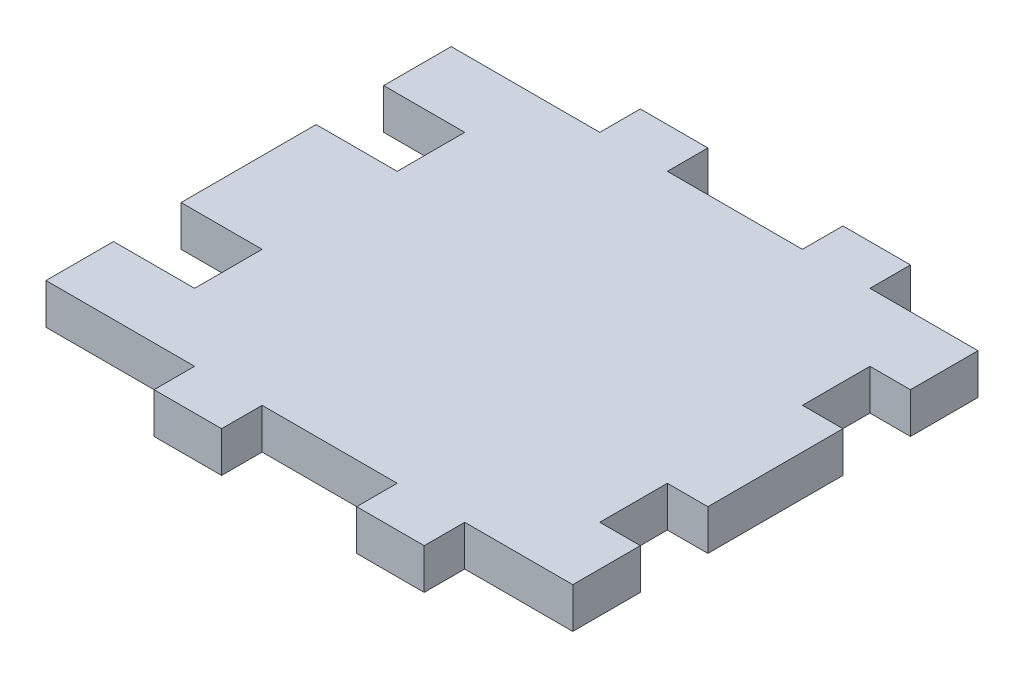
from build123d import *

# Parameters (mm, degrees)
BOSS_EXTRUDE1_DEPTH = 6


with BuildPart() as part:
    # Sketch1 → Boss-Extrude1 (new body)
    with BuildSketch(Plane(origin=(0, 0, 0), x_dir=(1, 0, 0), z_dir=(0, 1, 0))):
        Polygon((-42, 30), (-42, 20), (-30, 20), (-30, 10), (-42, 10), (-42, -10), (-30, -10), (-30, -20), (-42, -20), (-42, -30), (-20, -30), (-20, -36), (-10, -36), (-10, -30), (10, -30), (10, -36), (20, -36), (20, -30), (36, -30), (36, -20), (30, -20), (30, -10), (36, -10), (36, 10), (30, 10), (30, 20), (36, 20), (36, 30), (20, 30), (20, 36), (10, 36), (10, 30), (-10, 30), (-10, 36), (-20, 36), (-20, 30), align=None)
    extrude(amount=BOSS_EXTRUDE1_DEPTH)


solid = part.part
